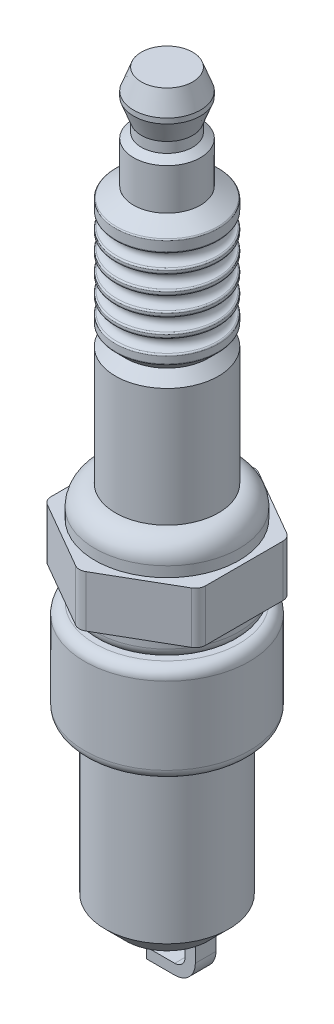
from build123d import *

# Parameters (mm, degrees)
BOSS_EXTRUDE1_DEPTH      = 5
FILLET1_R                = 1
BOSS_EXTRUDE2_DEPTH      = 1
BOSS_EXTRUDE2_DEPTH_BACK = 1


with BuildPart() as part:
    # Sketch1 → Revolve1 (revolve)
    with BuildSketch(Plane.XY):
        Polygon((0, 75), (2.5, 75), (3.25, 73), (3.25, 72.5), (2.5, 70.5), (2.5, 69.5), (3.25, 69), (3.25, 65), (0, 65), align=None)
    revolve(axis=Axis((0, 65, 0), (0, 1, 0)))


with BuildPart() as body_2:
    # Sketch2 → Revolve2 (revolve)
    with BuildSketch(Plane.XY):
        with BuildLine():
            Line((0, 65), (0, 40))
            Line((0, 40), (5, 40))
            Line((5, 40), (5, 51.5))
            Line((5, 51.5), (4, 52.5))
            Line((4, 52.5), (4.956066017, 53.456066017))
            ThreePointArc((4.956066017, 53.456066017), (4.98858193, 53.50472952), (5, 53.562132034))
            Line((5, 53.562132034), (5, 54.214188318))
            ThreePointArc((5, 54.214188318), (4.965582763, 54.309794934), (4.878125, 54.361528008))
            ThreePointArc((4.878125, 54.361528008), (4.35, 55), (4.878125, 55.638471992))
            ThreePointArc((4.878125, 55.638471992), (4.965582763, 55.690205066), (5, 55.785811682))
            Line((5, 55.785811682), (5, 56.014188318))
            ThreePointArc((5, 56.014188318), (4.965582763, 56.109794934), (4.878125, 56.161528008))
            ThreePointArc((4.878125, 56.161528008), (4.35, 56.8), (4.878125, 57.438471992))
            ThreePointArc((4.878125, 57.438471992), (4.965582763, 57.490205066), (5, 57.585811682))
            Line((5, 57.585811682), (5, 57.814188318))
            ThreePointArc((5, 57.814188318), (4.965582763, 57.909794934), (4.878125, 57.961528008))
            ThreePointArc((4.878125, 57.961528008), (4.35, 58.6), (4.878125, 59.238471992))
            ThreePointArc((4.878125, 59.238471992), (4.965582763, 59.290205066), (5, 59.385811682))
            Line((5, 59.385811682), (5, 59.614188318))
            ThreePointArc((5, 59.614188318), (4.965582763, 59.709794934), (4.878125, 59.761528008))
            ThreePointArc((4.878125, 59.761528008), (4.35, 60.4), (4.878125, 61.038471992))
            ThreePointArc((4.878125, 61.038471992), (4.965582763, 61.090205066), (5, 61.185811682))
            Line((5, 61.185811682), (5, 61.414188318))
            ThreePointArc((5, 61.414188318), (4.965582763, 61.509794934), (4.878125, 61.561528008))
            ThreePointArc((4.878125, 61.561528008), (4.35, 62.2), (4.878125, 62.838471992))
            ThreePointArc((4.878125, 62.838471992), (4.965582763, 62.890205066), (5, 62.985811682))
            Line((5, 62.985811682), (5, 63.91295162))
            ThreePointArc((5, 63.91295162), (4.979736514, 63.988240642), (4.924420841, 64.043188091))
            Line((4.924420841, 64.043188091), (3.25, 65))
            Line((3.25, 65), (0, 65))
        make_face()
    revolve(axis=Axis((0, 65, 0), (0, -1, 0)))


with BuildPart() as body_3:
    # Sketch3 → Revolve3 (revolve)
    with BuildSketch(Plane.XY):
        with BuildLine():
            Line((7, 38), (7, 31))
            ThreePointArc((7, 31), (6.707106781, 30.292893219), (6, 30))
            Line((6, 30), (0, 30))
            Line((0, 30), (0, 40))
            Line((0, 40), (5, 40))
            ThreePointArc((5, 40), (6.414213562, 39.414213562), (7, 38))
        make_face()
    revolve(axis=Axis((0, 30, 0), (0, 1, 0)))


with BuildPart() as body_4:
    # Sketch4 → Revolve4 (revolve)
    with BuildSketch(Plane.XY):
        with BuildLine():
            Line((0, 30), (0, 20.5))
            Line((0, 20.5), (7, 20.5))
            ThreePointArc((7, 20.5), (7.707106781, 20.792893219), (8, 21.5))
            Line((8, 21.5), (8, 29))
            ThreePointArc((8, 29), (7.707106781, 29.707106781), (7, 30))
            Line((7, 30), (0, 30))
        make_face()
    revolve(axis=Axis((0, 30, 0), (0, -1, 0)))


with BuildPart() as body_5:
    # Sketch5 → Revolve5 (revolve)
    with BuildSketch(Plane.XY):
        Polygon((0, 20.5), (0, 3.5), (4, 3.5), (6, 5.5), (6, 20.5), align=None)
    revolve(axis=Axis((0, 20.5, 0), (0, -1, 0)))

    # Sketch7 → Boss-Extrude2 (add, two sides: drawn at the far end of the back side and taken through both)
    with BuildSketch(Plane.XY.offset(-BOSS_EXTRUDE2_DEPTH_BACK)):
        with BuildLine():
            Line((-1, 0), (1.75, 0))
            ThreePointArc((1.75, 0), (3.164213562, 0.585786438), (3.75, 2))
            Line((3.75, 2), (3.75, 3.5))
            Line((3.75, 3.5), (2.75, 3.5))
            Line((2.75, 3.5), (2.75, 2))
            ThreePointArc((2.75, 2), (2.457106781, 1.292893219), (1.75, 1))
            Line((1.75, 1), (-1, 1))
            Line((-1, 1), (-1, 0))
        make_face()
    extrude(amount=BOSS_EXTRUDE2_DEPTH + BOSS_EXTRUDE2_DEPTH_BACK)


with BuildPart() as body_6:
    # Sketch6 → Boss-Extrude1 (new body)
    with BuildSketch(Plane(origin=(0, 32, 0), x_dir=(1, 0, 0), z_dir=(0, 1, 0))):
        Polygon((0, 8.660254038), (-7.5, 4.330127019), (-7.5, -4.330127019), (0, -8.660254038), (7.5, -4.330127019), (7.5, 4.330127019), align=None)
    extrude(amount=BOSS_EXTRUDE1_DEPTH)

    # Fillet1
    fillet1_edges = [body_6.edges().sort_by_distance(p)[0] for p in [
        (-7.5, 34.5, -4.330127019),
        (0, 34.5, -8.660254038),
        (7.5, 34.5, -4.330127019),
        (-7.5, 34.5, 4.330127019),
        (7.5, 34.5, 4.330127019),
        (0, 34.5, 8.660254038),
    ]]
    fillet(fillet1_edges, radius=FILLET1_R)


solid = Compound([part.part, body_2.part, body_3.part, body_4.part, body_5.part, body_6.part])
